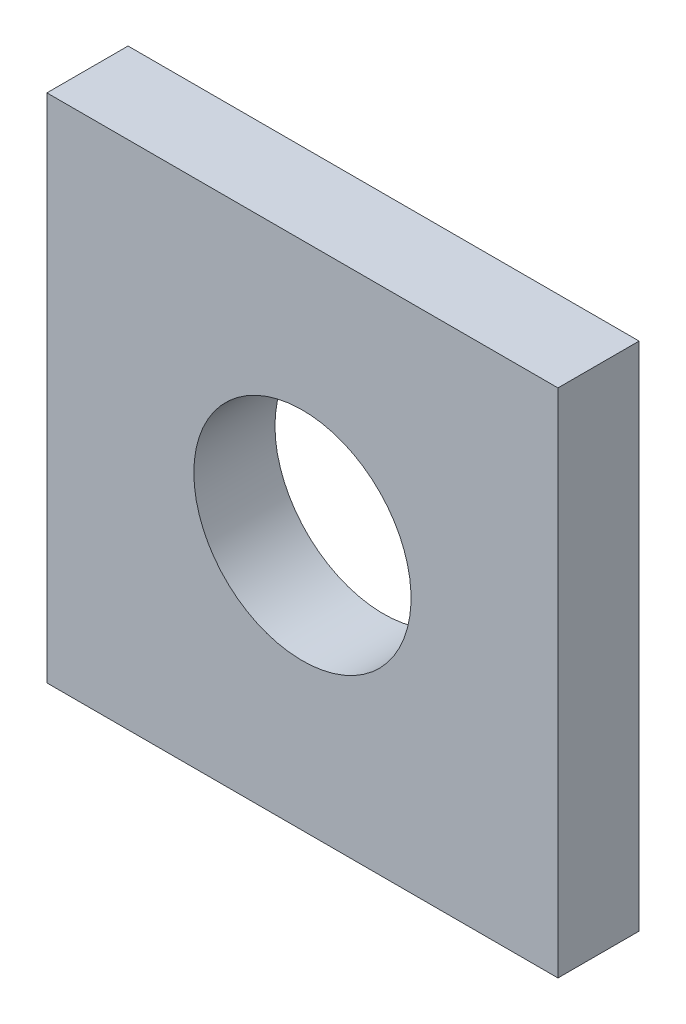
from build123d import *

# Parameters (mm, degrees)
SKETCH1_W           = 20
SKETCH1_H           = 20
BOSS_EXTRUDE1_DEPTH = 3.175
SKETCH2_R           = 4.25
CUT_EXTRUDE1_DEPTH  = 3.175


with BuildPart() as part:
    # Sketch1 → Boss-Extrude1 (new body)
    with BuildSketch(Plane.XY):
        with Locations((10, 10)):
            Rectangle(SKETCH1_W, SKETCH1_H)
    extrude(amount=BOSS_EXTRUDE1_DEPTH)

    # Sketch2 → Cut-Extrude1 (cut)
    with BuildSketch(Plane(origin=(0, 0, 0), x_dir=(-1, 0, 0), z_dir=(0, 0, -1))):
        with Locations((-10, 10)):
            Circle(SKETCH2_R)
    extrude(amount=-CUT_EXTRUDE1_DEPTH, mode=Mode.SUBTRACT)


solid = part.part
